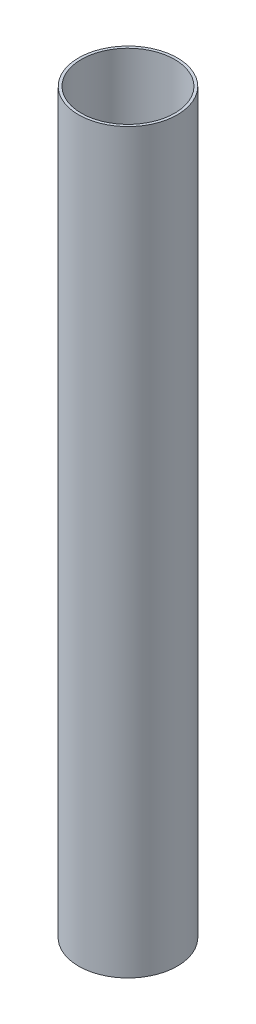
from build123d import *

# Parameters (mm, degrees)
SKETCH1_R           = 28.9052
SKETCH1_R_2         = 27.3304
BOSS_EXTRUDE1_DEPTH = 431.8


with BuildPart() as part:
    # Sketch1 → Boss-Extrude1 (new body)
    with BuildSketch(Plane(origin=(0, 0, 0), x_dir=(1, 0, 0), z_dir=(0, 1, 0))):
        with Locations(Location((0, 0, 0), (0, 0, 270))):
            Circle(SKETCH1_R)
        with Locations(Location((0, 0, 0), (0, 0, 270))):
            Circle(SKETCH1_R_2, mode=Mode.SUBTRACT)
    extrude(amount=BOSS_EXTRUDE1_DEPTH)


solid = part.part
